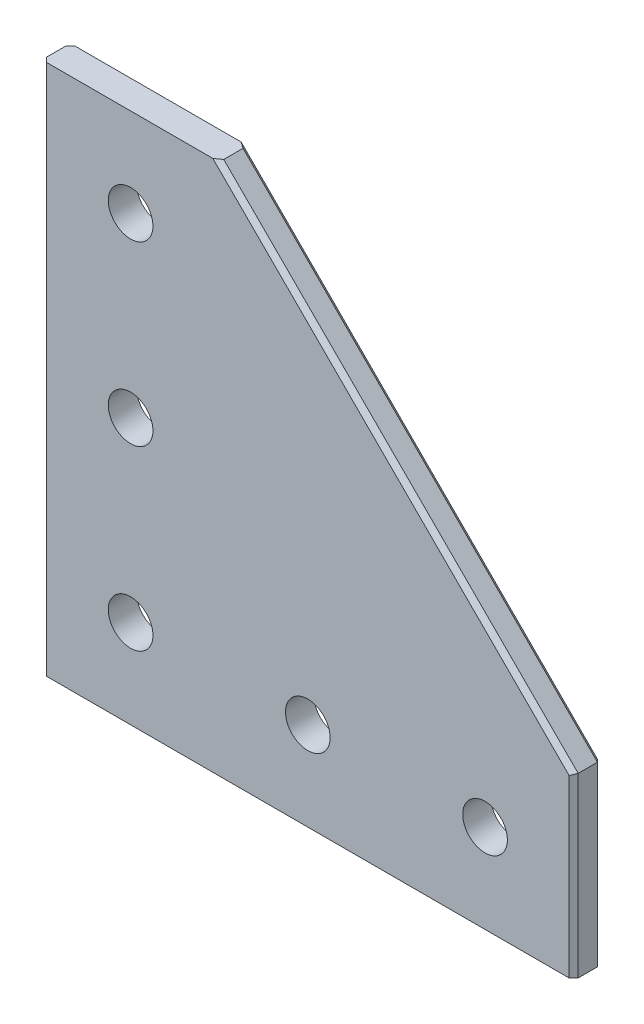
from build123d import *

# Parameters (mm, degrees)
SKETCH1_R      = 3.15
EXTRUDE1_DEPTH = 4
CHAMFER1_SIZE  = 0.64


with BuildPart() as part:
    # Sketch1 → Extrude1 (new body)
    with BuildSketch(Plane.XY):
        Polygon((-23.945658648, 33.397892325), (-23.945658648, -41.602107675), (51.054341352, -41.602107675), (51.054341352, -16.602107675), (1.054341352, 33.397892325), align=None)
        with Locations((-11.445658648, -29.102107675)):
            Circle(SKETCH1_R, mode=Mode.SUBTRACT)
        with Locations((-11.445658648, -4.102107675)):
            Circle(SKETCH1_R, mode=Mode.SUBTRACT)
        with Locations((-11.445658648, 20.897892325)):
            Circle(SKETCH1_R, mode=Mode.SUBTRACT)
        with Locations((13.554341352, -29.102107675)):
            Circle(SKETCH1_R, mode=Mode.SUBTRACT)
        with Locations((38.554341352, -29.102107675)):
            Circle(SKETCH1_R, mode=Mode.SUBTRACT)
    extrude(amount=EXTRUDE1_DEPTH)

    # Chamfer1
    chamfer1_edges = [part.edges().sort_by_distance(p)[0] for p in [
        (51.054341352, -29.102107675, 4),
        (26.054341352, 8.397892325, 4),
        (26.054341352, 8.397892325, 0),
        (51.054341352, -29.102107675, 0),
        (-23.945658648, -4.102107675, 0),
        (-23.945658648, -4.102107675, 4),
    ]]
    chamfer(chamfer1_edges, length=CHAMFER1_SIZE)


solid = part.part
